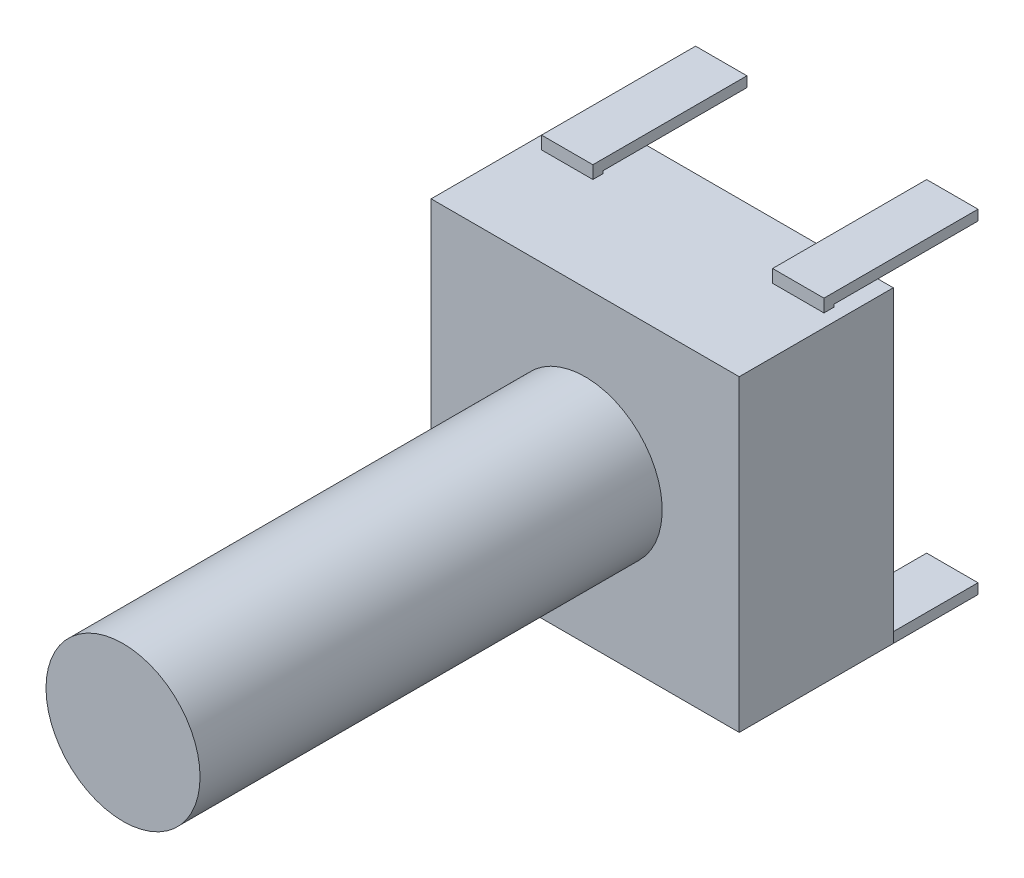
from build123d import *

# Parameters (mm, degrees)
SKETCH_1_W               = 6
SKETCH_1_H               = 6
EXTRUDE_1_DEPTH          = 3
SKETCH_2_R               = 1.5
EXTRUDE_2_DEPTH          = 9
SKETCH_4_W               = 1
SKETCH_4_H               = 0.2
MIRROR_2_COPY_1_SKETCH_W = 1
MIRROR_2_COPY_1_SKETCH_H = 0.2


with BuildPart() as part:
    # 草图1 → 凸台-拉伸1 (new body)
    with BuildSketch(Plane.XY):
        Rectangle(SKETCH_1_W, SKETCH_1_H)
    extrude(amount=EXTRUDE_1_DEPTH)

    # 草图2 → 凸台-拉伸2 (add)
    with BuildSketch(Plane.XY.offset(3)):
        with Locations(Location((0, 0, 0), (0, 0, 180))):
            Circle(SKETCH_2_R)
    extrude(amount=EXTRUDE_2_DEPTH)

    # 扫描3: sweep along a path in 草图6
    with BuildLine(Plane(origin=(2.25, 0, 0), x_dir=(0, 0, -1), z_dir=(1, 0, 0))) as sweep_3_path:
        Line((-1.1, -3), (-1.1, -3.25))
        Line((-1.1, -3.25), (1.9, -3.25))
    # 草图4 → 扫描3 (sweep)
    with BuildSketch(Plane.XZ.offset(3)):
        with Locations((2.25, 1)):
            Rectangle(SKETCH_4_W, SKETCH_4_H)
    sweep_3 = sweep(path=sweep_3_path.line, transition=Transition.RIGHT)

    # 镜向1: 扫描3 across plane
    add(sweep_3.mirror(Plane(origin=(0, 0, 0), x_dir=(0, 0, 1), z_dir=(1, 0, 0))))

    # 镜向2: 扫描3 across plane
    add(sweep_3.mirror(Plane.ZX))

    # 镜向2 copy 1: sweep along a path in 镜向2 copy 1 path
    with BuildLine(Plane(origin=(-2.25, 0, 0), x_dir=(0, 0, -1), z_dir=(-1, 0, 0))) as mirror_2_copy_1_path:
        Line((-1.1, -3), (-1.1, -3.25))
        Line((-1.1, -3.25), (1.9, -3.25))
    # 镜向2 copy 1 sketch → 镜向2 copy 1 (sweep)
    with BuildSketch(Plane(origin=(0, 3, 0), x_dir=(-1, 0, 0), z_dir=(0, 1, 0))):
        with Locations((2.25, 1)):
            Rectangle(MIRROR_2_COPY_1_SKETCH_W, MIRROR_2_COPY_1_SKETCH_H)
    sweep(path=mirror_2_copy_1_path.line, transition=Transition.RIGHT)


solid = part.part
